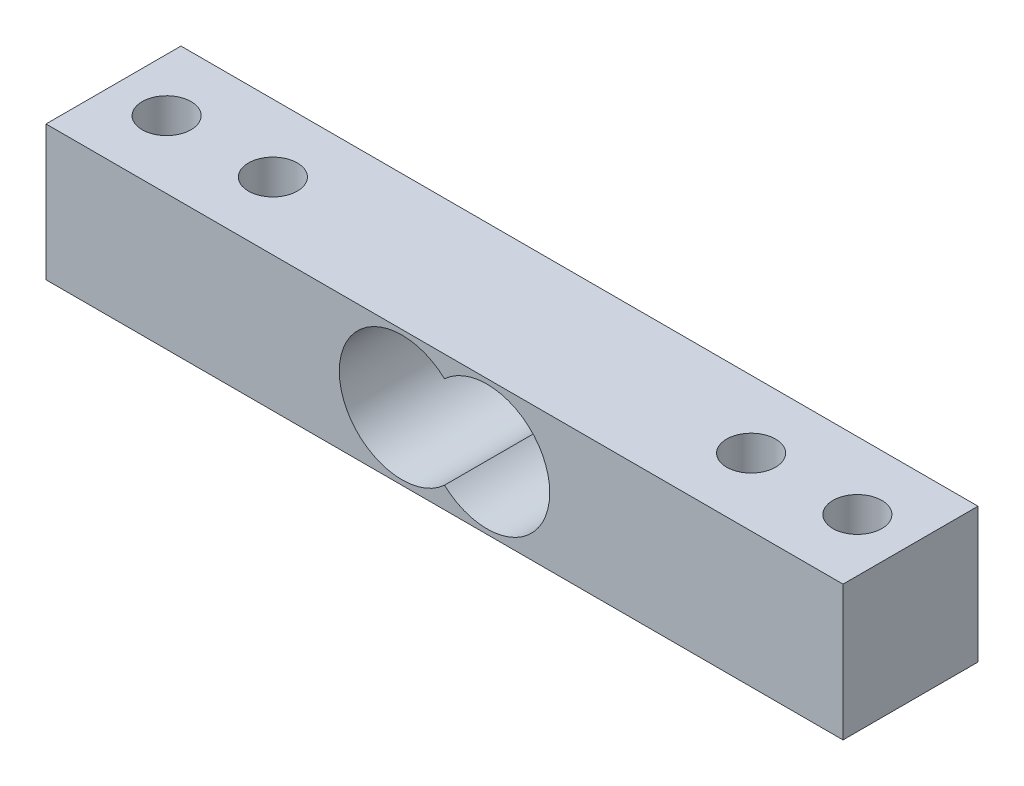
from build123d import *

# Parameters (mm, degrees)
CROQUIS2_W              = 75
CROQUIS2_H              = 12.7
SALIENTE_EXTRUIR1_DEPTH = 6.35
CROQUIS3_R              = 2.3
CORTAR_EXTRUIR1_DEPTH   = 41.098160806


with BuildPart() as part:
    # Croquis2 → Saliente-Extruir1 (new, symmetric)
    with BuildSketch(Plane.XY):
        Rectangle(CROQUIS2_W, CROQUIS2_H)
        with BuildLine():
            ThreePointArc((0, 4.337049688), (-9.9, 0), (0, -4.337049688))
            ThreePointArc((0, -4.337049688), (9.9, 0), (0, 4.337049688))
        make_face(mode=Mode.SUBTRACT)
    extrude(amount=SALIENTE_EXTRUIR1_DEPTH, both=True)

    # Croquis3 → Cortar-Extruir1 (cut, through all)
    with BuildSketch(Plane(origin=(0, 6.35, 0), x_dir=(1, 0, 0), z_dir=(0, 1, 0))):
        with Locations(Location((32.5, 0, 0), (0, 0, 270))):
            Circle(CROQUIS3_R)
        with Locations(Location((22.5, 0, 0), (0, 0, 270))):
            Circle(CROQUIS3_R)
        with Locations(Location((-32.5, 0, 0), (0, 0, 90))):
            Circle(CROQUIS3_R)
        with Locations(Location((-22.5, 0, 0), (0, 0, 90))):
            Circle(CROQUIS3_R)
    extrude(amount=-CORTAR_EXTRUIR1_DEPTH, mode=Mode.SUBTRACT)


solid = part.part
